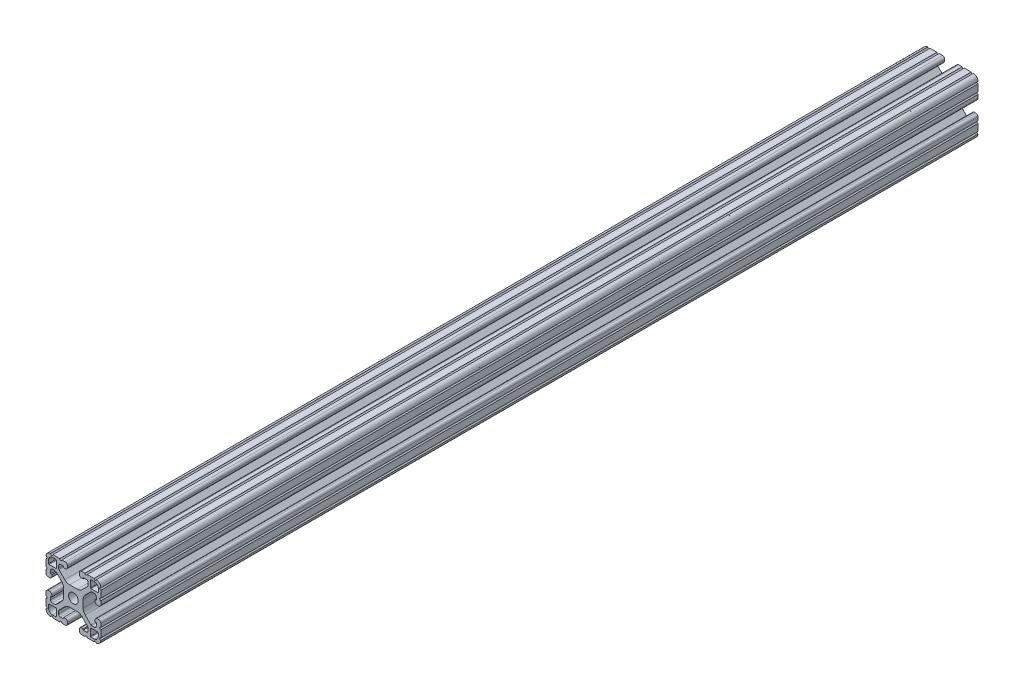
from build123d import *

# Parameters (mm, degrees)
SKETCH1_R           = 3.3274
BOSS_EXTRUDE1_DEPTH = 304.8


with BuildPart() as part:
    # Sketch1 → Boss-Extrude1 (new, symmetric)
    with BuildSketch(Plane.XY):
        with BuildLine():
            Line((-10.02670034, 12.151875049), (-6.021451835, 8.147301292))
            ThreePointArc((-6.021451835, 8.147301292), (-4.48060392, 7.11788044), (-2.663118988, 6.7564))
            Line((-2.663118988, 6.7564), (2.663118988, 6.7564))
            ThreePointArc((2.663118988, 6.7564), (4.48060392, 7.11788044), (6.021451835, 8.147301292))
            Line((6.021451835, 8.147301292), (10.02670034, 12.151875049))
            ThreePointArc((10.02670034, 12.151875049), (10.219349756, 12.440155844), (10.287, 12.78021916))
            Line((10.287, 12.78021916), (10.287, 14.55471092))
            ThreePointArc((10.287, 14.55471092), (9.915025612, 15.452736532), (9.017, 15.82471092))
            Line((9.017, 15.82471092), (6.814144259, 15.82471092))
            Line((6.814144259, 15.82471092), (6.814144259, 14.986))
            Line((6.814144259, 14.986), (5.6388, 14.986))
            ThreePointArc((5.6388, 14.986), (4.525248241, 15.447248241), (4.064, 16.5608))
            Line((4.064, 16.5608), (4.064, 17.4752))
            ThreePointArc((4.064, 17.4752), (4.525248241, 18.588751759), (5.6388, 19.05))
            Line((5.6388, 19.05), (7.9756, 19.05))
            ThreePointArc((7.9756, 19.05), (8.7376, 18.288), (9.4996, 19.05))
            Line((9.4996, 19.05), (14.3256, 19.05))
            ThreePointArc((14.3256, 19.05), (15.0876, 18.288), (15.8496, 19.05))
            Line((15.8496, 19.05), (15.875, 19.05))
            ThreePointArc((15.875, 19.05), (18.12006403, 18.12006403), (19.05, 15.875))
            Line((19.05, 15.875), (19.05, 15.8496))
            ThreePointArc((19.05, 15.8496), (18.288, 15.0876), (19.05, 14.3256))
            Line((19.05, 14.3256), (19.05, 9.4996))
            ThreePointArc((19.05, 9.4996), (18.288, 8.7376), (19.05, 7.9756))
            Line((19.05, 7.9756), (19.05, 5.6388))
            ThreePointArc((19.05, 5.6388), (18.588751759, 4.525248241), (17.4752, 4.064))
            Line((17.4752, 4.064), (16.5608, 4.064))
            ThreePointArc((16.5608, 4.064), (15.447248241, 4.525248241), (14.986, 5.6388))
            Line((14.986, 5.6388), (14.986, 6.750644259))
            Line((14.986, 6.750644259), (15.879033733, 6.750644259))
            Line((15.879033733, 6.750644259), (15.879033733, 8.919211783))
            ThreePointArc((15.879033733, 8.919211783), (15.507059345, 9.817237395), (14.609033733, 10.189211783))
            Line((14.609033733, 10.189211783), (12.742784468, 10.189211783))
            ThreePointArc((12.742784468, 10.189211783), (12.402613491, 10.121555016), (12.114219497, 9.928882664))
            Line((12.114219497, 9.928882664), (8.147867153, 5.963198517))
            ThreePointArc((8.147867153, 5.963198517), (7.118033561, 4.422154408), (6.7564, 2.604299809))
            Line((6.7564, 2.604299809), (6.7564, -2.604299809))
            ThreePointArc((6.7564, -2.604299809), (7.118033561, -4.422154408), (8.147867153, -5.963198517))
            Line((8.147867153, -5.963198517), (12.114219497, -9.928882664))
            ThreePointArc((12.114219497, -9.928882664), (12.402613491, -10.121555016), (12.742784468, -10.189211783))
            Line((12.742784468, -10.189211783), (14.609033733, -10.189211783))
            ThreePointArc((14.609033733, -10.189211783), (15.507059345, -9.817237395), (15.879033733, -8.919211783))
            Line((15.879033733, -8.919211783), (15.879033733, -6.750644259))
            Line((15.879033733, -6.750644259), (14.986, -6.750644259))
            Line((14.986, -6.750644259), (14.986, -5.6388))
            ThreePointArc((14.986, -5.6388), (15.447248241, -4.525248241), (16.5608, -4.064))
            Line((16.5608, -4.064), (17.4752, -4.064))
            ThreePointArc((17.4752, -4.064), (18.588751759, -4.525248241), (19.05, -5.6388))
            Line((19.05, -5.6388), (19.05, -7.9756))
            ThreePointArc((19.05, -7.9756), (18.288, -8.7376), (19.05, -9.4996))
            Line((19.05, -9.4996), (19.05, -14.3256))
            ThreePointArc((19.05, -14.3256), (18.288, -15.0876), (19.05, -15.8496))
            Line((19.05, -15.8496), (19.05, -15.875))
            ThreePointArc((19.05, -15.875), (18.12006403, -18.12006403), (15.875, -19.05))
            Line((15.875, -19.05), (15.8496, -19.05))
            ThreePointArc((15.8496, -19.05), (15.0876, -18.288), (14.3256, -19.05))
            Line((14.3256, -19.05), (9.4996, -19.05))
            ThreePointArc((9.4996, -19.05), (8.7376, -18.288), (7.9756, -19.05))
            Line((7.9756, -19.05), (5.6388, -19.05))
            ThreePointArc((5.6388, -19.05), (4.525248241, -18.588751759), (4.064, -17.4752))
            Line((4.064, -17.4752), (4.064, -16.5608))
            ThreePointArc((4.064, -16.5608), (4.525248241, -15.447248241), (5.6388, -14.986))
            Line((5.6388, -14.986), (6.814144259, -14.986))
            Line((6.814144259, -14.986), (6.814144259, -15.82471092))
            Line((6.814144259, -15.82471092), (9.017, -15.82471092))
            ThreePointArc((9.017, -15.82471092), (9.915025612, -15.452736532), (10.287, -14.55471092))
            Line((10.287, -14.55471092), (10.287, -12.78021916))
            ThreePointArc((10.287, -12.78021916), (10.219349756, -12.440155844), (10.02670034, -12.151875049))
            Line((10.02670034, -12.151875049), (6.021451835, -8.147301292))
            ThreePointArc((6.021451835, -8.147301292), (4.48060392, -7.11788044), (2.663118988, -6.7564))
            Line((2.663118988, -6.7564), (-2.663118988, -6.7564))
            ThreePointArc((-2.663118988, -6.7564), (-4.48060392, -7.11788044), (-6.021451835, -8.147301292))
            Line((-6.021451835, -8.147301292), (-10.02670034, -12.151875049))
            ThreePointArc((-10.02670034, -12.151875049), (-10.219349756, -12.440155844), (-10.287, -12.78021916))
            Line((-10.287, -12.78021916), (-10.287, -14.55471092))
            ThreePointArc((-10.287, -14.55471092), (-9.915025612, -15.452736532), (-9.017, -15.82471092))
            Line((-9.017, -15.82471092), (-6.814144259, -15.82471092))
            Line((-6.814144259, -15.82471092), (-6.814144259, -14.986))
            Line((-6.814144259, -14.986), (-5.6388, -14.986))
            ThreePointArc((-5.6388, -14.986), (-4.525248241, -15.447248241), (-4.064, -16.5608))
            Line((-4.064, -16.5608), (-4.064, -17.4752))
            ThreePointArc((-4.064, -17.4752), (-4.525248241, -18.588751759), (-5.6388, -19.05))
            Line((-5.6388, -19.05), (-7.9756, -19.05))
            ThreePointArc((-7.9756, -19.05), (-8.7376, -18.288), (-9.4996, -19.05))
            Line((-9.4996, -19.05), (-14.3256, -19.05))
            ThreePointArc((-14.3256, -19.05), (-15.0876, -18.288), (-15.8496, -19.05))
            Line((-15.8496, -19.05), (-15.875, -19.05))
            ThreePointArc((-15.875, -19.05), (-18.12006403, -18.12006403), (-19.05, -15.875))
            Line((-19.05, -15.875), (-19.05, -15.8496))
            ThreePointArc((-19.05, -15.8496), (-18.288, -15.0876), (-19.05, -14.3256))
            Line((-19.05, -14.3256), (-19.05, -9.4996))
            ThreePointArc((-19.05, -9.4996), (-18.288, -8.7376), (-19.05, -7.9756))
            Line((-19.05, -7.9756), (-19.05, -5.6388))
            ThreePointArc((-19.05, -5.6388), (-18.588751759, -4.525248241), (-17.4752, -4.064))
            Line((-17.4752, -4.064), (-16.5608, -4.064))
            ThreePointArc((-16.5608, -4.064), (-15.447248241, -4.525248241), (-14.986, -5.6388))
            Line((-14.986, -5.6388), (-14.986, -6.750644259))
            Line((-14.986, -6.750644259), (-15.879033733, -6.750644259))
            Line((-15.879033733, -6.750644259), (-15.879033733, -8.919211783))
            ThreePointArc((-15.879033733, -8.919211783), (-15.507059345, -9.817237395), (-14.609033733, -10.189211783))
            Line((-14.609033733, -10.189211783), (-12.742784468, -10.189211783))
            ThreePointArc((-12.742784468, -10.189211783), (-12.402613491, -10.121555016), (-12.114219497, -9.928882664))
            Line((-12.114219497, -9.928882664), (-8.147867153, -5.963198517))
            ThreePointArc((-8.147867153, -5.963198517), (-7.118033561, -4.422154408), (-6.7564, -2.604299809))
            Line((-6.7564, -2.604299809), (-6.7564, 2.604299809))
            ThreePointArc((-6.7564, 2.604299809), (-7.118033561, 4.422154408), (-8.147867153, 5.963198517))
            Line((-8.147867153, 5.963198517), (-12.114219497, 9.928882664))
            ThreePointArc((-12.114219497, 9.928882664), (-12.402613491, 10.121555016), (-12.742784468, 10.189211783))
            Line((-12.742784468, 10.189211783), (-14.609033733, 10.189211783))
            ThreePointArc((-14.609033733, 10.189211783), (-15.507059345, 9.817237395), (-15.879033733, 8.919211783))
            Line((-15.879033733, 8.919211783), (-15.879033733, 6.750644259))
            Line((-15.879033733, 6.750644259), (-14.986, 6.750644259))
            Line((-14.986, 6.750644259), (-14.986, 5.6388))
            ThreePointArc((-14.986, 5.6388), (-15.447248241, 4.525248241), (-16.5608, 4.064))
            Line((-16.5608, 4.064), (-17.4752, 4.064))
            ThreePointArc((-17.4752, 4.064), (-18.588751759, 4.525248241), (-19.05, 5.6388))
            Line((-19.05, 5.6388), (-19.05, 7.9756))
            ThreePointArc((-19.05, 7.9756), (-18.288, 8.7376), (-19.05, 9.4996))
            Line((-19.05, 9.4996), (-19.05, 14.3256))
            ThreePointArc((-19.05, 14.3256), (-18.288, 15.0876), (-19.05, 15.8496))
            Line((-19.05, 15.8496), (-19.05, 15.875))
            ThreePointArc((-19.05, 15.875), (-18.12006403, 18.12006403), (-15.875, 19.05))
            Line((-15.875, 19.05), (-15.8496, 19.05))
            ThreePointArc((-15.8496, 19.05), (-15.0876, 18.288), (-14.3256, 19.05))
            Line((-14.3256, 19.05), (-9.4996, 19.05))
            ThreePointArc((-9.4996, 19.05), (-8.7376, 18.288), (-7.9756, 19.05))
            Line((-7.9756, 19.05), (-5.6388, 19.05))
            ThreePointArc((-5.6388, 19.05), (-4.525248241, 18.588751759), (-4.064, 17.4752))
            Line((-4.064, 17.4752), (-4.064, 16.5608))
            ThreePointArc((-4.064, 16.5608), (-4.525248241, 15.447248241), (-5.6388, 14.986))
            Line((-5.6388, 14.986), (-6.814144259, 14.986))
            Line((-6.814144259, 14.986), (-6.814144259, 15.82471092))
            Line((-6.814144259, 15.82471092), (-9.017, 15.82471092))
            ThreePointArc((-9.017, 15.82471092), (-9.915025612, 15.452736532), (-10.287, 14.55471092))
            Line((-10.287, 14.55471092), (-10.287, 12.78021916))
            ThreePointArc((-10.287, 12.78021916), (-10.219349756, 12.440155844), (-10.02670034, 12.151875049))
        make_face()
        with Locations(Location((0, 0, 0), (0, 0, 180))):
            Circle(SKETCH1_R, mode=Mode.SUBTRACT)
        with BuildLine():
            Line((-16.891, 11.8618), (-12.2428, 11.8618))
            ThreePointArc((-12.2428, 11.8618), (-11.973392316, 11.973392316), (-11.8618, 12.2428))
            Line((-11.8618, 12.2428), (-11.8618, 16.891))
            ThreePointArc((-11.8618, 16.891), (-11.973392316, 17.160407684), (-12.2428, 17.272))
            Line((-12.2428, 17.272), (-14.478, 17.272))
            ThreePointArc((-14.478, 17.272), (-16.453656347, 16.453656347), (-17.272, 14.478))
            Line((-17.272, 14.478), (-17.272, 12.2428))
            ThreePointArc((-17.272, 12.2428), (-17.160407684, 11.973392316), (-16.891, 11.8618))
        make_face(mode=Mode.SUBTRACT)
        with BuildLine():
            Line((-17.272, -14.478), (-17.272, -12.2428))
            ThreePointArc((-17.272, -12.2428), (-17.160407684, -11.973392316), (-16.891, -11.8618))
            Line((-16.891, -11.8618), (-12.2428, -11.8618))
            ThreePointArc((-12.2428, -11.8618), (-11.973392316, -11.973392316), (-11.8618, -12.2428))
            Line((-11.8618, -12.2428), (-11.8618, -16.891))
            ThreePointArc((-11.8618, -16.891), (-11.973392316, -17.160407684), (-12.2428, -17.272))
            Line((-12.2428, -17.272), (-14.478, -17.272))
            ThreePointArc((-14.478, -17.272), (-16.453656347, -16.453656347), (-17.272, -14.478))
        make_face(mode=Mode.SUBTRACT)
        with BuildLine():
            Line((17.272, 14.478), (17.272, 12.2428))
            ThreePointArc((17.272, 12.2428), (17.160407684, 11.973392316), (16.891, 11.8618))
            Line((16.891, 11.8618), (12.2428, 11.8618))
            ThreePointArc((12.2428, 11.8618), (11.973392316, 11.973392316), (11.8618, 12.2428))
            Line((11.8618, 12.2428), (11.8618, 16.891))
            ThreePointArc((11.8618, 16.891), (11.973392316, 17.160407684), (12.2428, 17.272))
            Line((12.2428, 17.272), (14.478, 17.272))
            ThreePointArc((14.478, 17.272), (16.453656347, 16.453656347), (17.272, 14.478))
        make_face(mode=Mode.SUBTRACT)
        with BuildLine():
            Line((16.891, -11.8618), (12.2428, -11.8618))
            ThreePointArc((12.2428, -11.8618), (11.973392316, -11.973392316), (11.8618, -12.2428))
            Line((11.8618, -12.2428), (11.8618, -16.891))
            ThreePointArc((11.8618, -16.891), (11.973392316, -17.160407684), (12.2428, -17.272))
            Line((12.2428, -17.272), (14.478, -17.272))
            ThreePointArc((14.478, -17.272), (16.453656347, -16.453656347), (17.272, -14.478))
            Line((17.272, -14.478), (17.272, -12.2428))
            ThreePointArc((17.272, -12.2428), (17.160407684, -11.973392316), (16.891, -11.8618))
        make_face(mode=Mode.SUBTRACT)
    extrude(amount=BOSS_EXTRUDE1_DEPTH, both=True)


solid = part.part
